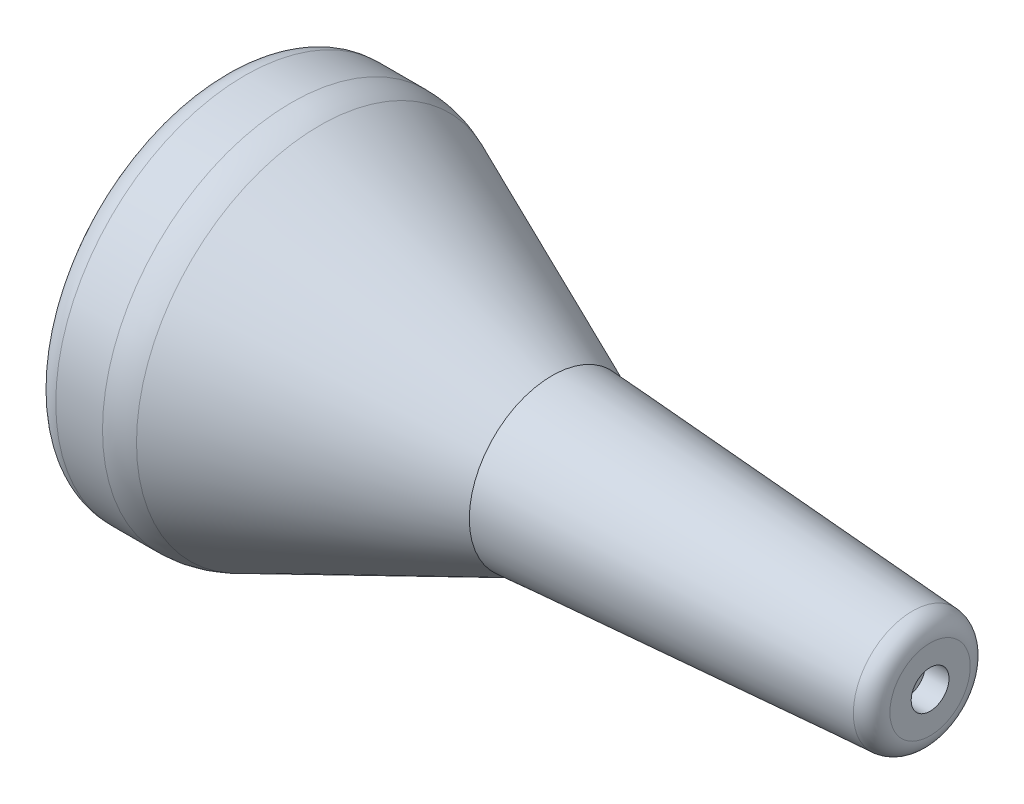
from build123d import *


with BuildPart() as part:
    # 草图1 → 旋转1 (revolve)
    with BuildSketch(Plane.XY):
        with BuildLine():
            Line((0, 0), (0, 7))
            ThreePointArc((0, 7), (0.292893219, 7.707106781), (1, 8))
            Line((1, 8), (2.978790918, 8))
            ThreePointArc((2.978790918, 8), (3.587095479, 7.937680303), (4.170127137, 7.753310373))
            Line((4.170127137, 7.753310373), (14, 3.5))
            Line((14, 3.5), (29.252387315, 2.499062082))
            ThreePointArc((29.252387315, 2.499062082), (29.783913457, 2.247629333), (30, 1.700779194))
            Line((30, 1.700779194), (30, 0.8))
            Line((30, 0.8), (29, 0.8))
            Line((29, 0.8), (29, 0))
            Line((29, 0), (0, 0))
        make_face()
    revolve(axis=Axis((30, 0, 0), (-1, 0, 0)))

    # 草图2 → 切除-旋转1 (revolve, cut)
    with BuildSketch(Plane.XY):
        with BuildLine():
            Line((8.9865, 0), (-3.5865, 0))
            ThreePointArc((-3.5865, 0), (2.7, 6.2865), (8.9865, 0))
        make_face()
    revolve(axis=Axis((50, 0, 0), (-1, 0, 0)), mode=Mode.SUBTRACT)


solid = part.part
